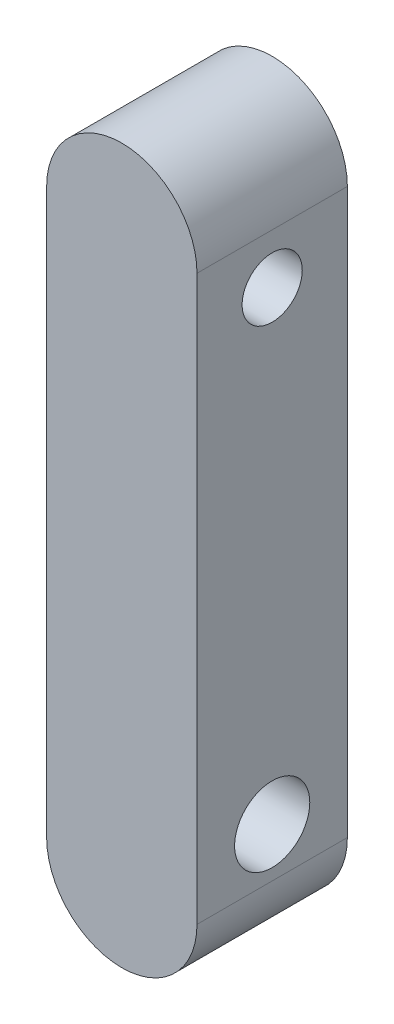
from build123d import *

# Parameters (mm, degrees)
SKETCH2_R           = 5
BOSS_EXTRUDE1_DEPTH = 20
SKETCH4_R           = 4
CUT_EXTRUDE1_DEPTH  = 28
SKETCH5_R           = 5
CUT_EXTRUDE2_DEPTH  = 30
BOSS_EXTRUDE2_START = -20
SKETCH12_R          = 5
BOSS_EXTRUDE2_DEPTH = 20
SKETCH13_R          = 5
CUT_EXTRUDE3_DEPTH  = 20


with BuildPart() as part:
    # Sketch2 → Boss-Extrude1 (new body)
    with BuildSketch(Plane.XY):
        with BuildLine():
            Line((-10, 0), (-10, 75))
            ThreePointArc((-10, 75), (0, 85), (10, 75))
            Line((10, 75), (10, 0))
            ThreePointArc((10, 0), (0, -10), (-10, 0))
        make_face()
        Circle(SKETCH2_R, mode=Mode.SUBTRACT)
    extrude(amount=BOSS_EXTRUDE1_DEPTH)

    # Sketch4 → Cut-Extrude1 (cut)
    with BuildSketch(Plane(origin=(10, 0, 0), x_dir=(0, 0, -1), z_dir=(1, 0, 0))):
        with Locations((-10, 68.36)):
            Circle(SKETCH4_R)
    extrude(amount=-CUT_EXTRUDE1_DEPTH, mode=Mode.SUBTRACT)

    # Sketch5 → Cut-Extrude2 (cut)
    with BuildSketch(Plane(origin=(10, 0, 0), x_dir=(0, 0, -1), z_dir=(1, 0, 0))):
        with Locations((-10, 6.54)):
            Circle(SKETCH5_R)
    extrude(amount=-CUT_EXTRUDE2_DEPTH, mode=Mode.SUBTRACT)

    # Sketch12 → Boss-Extrude2 (add)
    with BuildSketch(Plane.XY.offset(20).offset(BOSS_EXTRUDE2_START)):
        Circle(SKETCH12_R)
    extrude(amount=BOSS_EXTRUDE2_DEPTH)

    # Sketch13 → Cut-Extrude3 (cut)
    with BuildSketch(Plane(origin=(10, 0, 0), x_dir=(0, 0, -1), z_dir=(1, 0, 0))):
        with Locations((-10, 6.54)):
            Circle(SKETCH13_R)
    extrude(amount=-CUT_EXTRUDE3_DEPTH, mode=Mode.SUBTRACT)


solid = part.part
